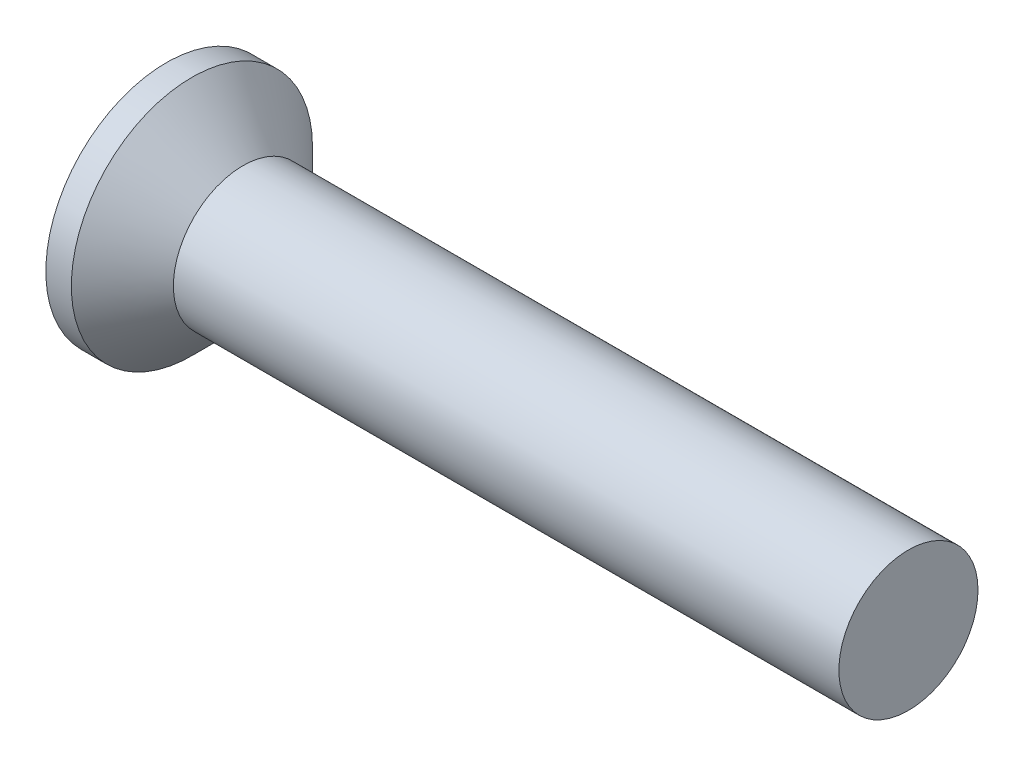
from build123d import *

# Parameters (mm, degrees)
CROSSRECESS_DEPTH = 0.825
DRAFT9_ANGLE      = 30
FILLET5_R         = 0.3


with BuildPart() as part:
    # Sketch1 → Base (revolve)
    with BuildSketch(Plane.XY, mode=Mode.PRIVATE) as base_sk:
        Polygon((16, 1.5), (2.65, 1.5), (1.65, 1.5), (0.55, 2.6), (0, 2.6), (0, 0), (16, 0), align=None)
    revolve(base_sk.sketch.rotate(Axis((4.515812911, 0, 0), (-1, 0, 0)), 90), axis=Axis((4.515812911, 0, 0), (-1, 0, 0)))

    # Sketch6 → CrossRecess (cut)
    with BuildSketch(Plane(origin=(0, 0, 0), x_dir=(0, 0, -1), z_dir=(1, 0, 0))):
        Polygon((0.32, 0.32), (0.32, 1.6), (-0.32, 1.6), (-0.32, 0.32), (-1.6, 0.32), (-1.6, -0.32), (-0.32, -0.32), (-0.32, -1.6), (0.32, -1.6), (0.32, -0.32), (1.6, -0.32), (1.6, 0.32), align=None)
    extrude(amount=CROSSRECESS_DEPTH, mode=Mode.SUBTRACT)

    # Draft9
    draft9_faces = [part.faces().sort_by_distance(p)[0] for p in [
        (0.4125, 1.6, 0),
        (0.4125, 0, 1.6),
        (0.4125, -1.6, 0),
        (0.4125, 0, -1.6),
    ]]
    draft(draft9_faces, Plane(origin=(0, 2.6, 0), x_dir=(0, 0, -1), z_dir=(-1, 0, 0)), DRAFT9_ANGLE)

    # Fillet5
    fillet5_edges = [part.edges().sort_by_distance(p)[0] for p in [
        (0.4125, 0.32, 0.32),
        (0.4125, -0.32, 0.32),
        (0.4125, -0.32, -0.32),
        (0.4125, 0.32, -0.32),
    ]]
    fillet(fillet5_edges, radius=FILLET5_R)


solid = part.part
